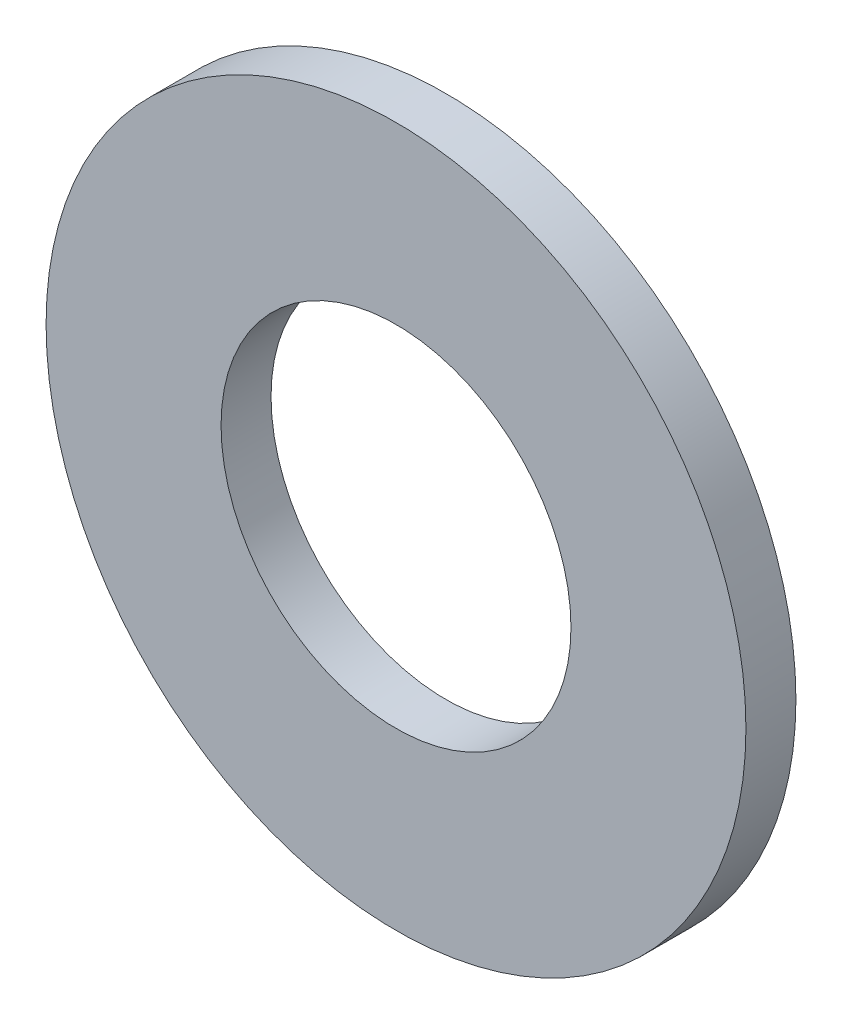
from build123d import *

# Parameters (mm, degrees)
SKETCH_1_R      = 14
SKETCH_1_R_2    = 7
EXTRUDE_1_DEPTH = 2


with BuildPart() as part:
    # Эскиз1 → Бобышка-Вытянуть1 (new body)
    with BuildSketch(Plane.XY):
        Circle(SKETCH_1_R)
        Circle(SKETCH_1_R_2, mode=Mode.SUBTRACT)
    extrude(amount=EXTRUDE_1_DEPTH)


solid = part.part
